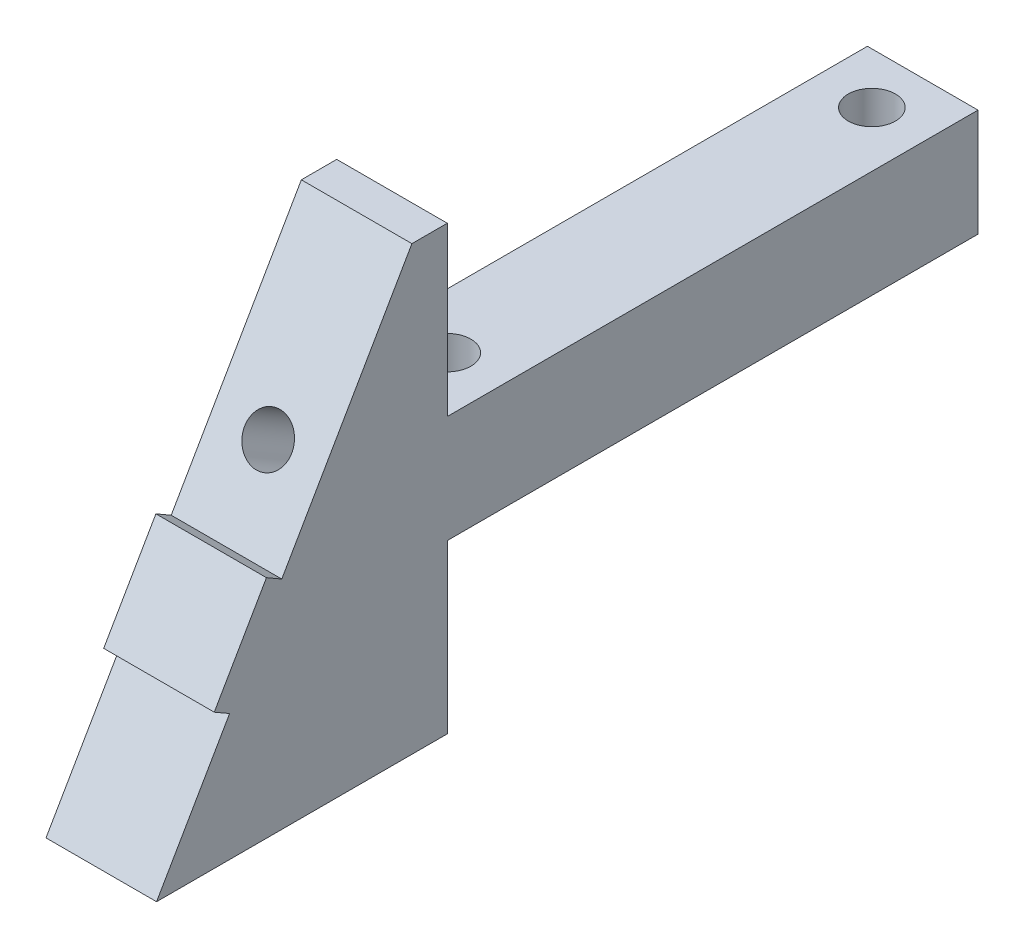
from build123d import *

# Parameters (mm, degrees)
BOSS_EXTRUDE1_DEPTH           = 6.35
SKETCH2_W                     = 6.35
SKETCH2_H                     = 6.35
BOSS_EXTRUDE2_DEPTH           = 30.48
SKETCH10_W                    = 6.35
SKETCH10_H                    = 6.1722
BOSS_EXTRUDE3_DEPTH           = 1.016
TAP_DRILL_FOR_6_32_TAP4_D     = 2.7051
TAP_DRILL_FOR_6_32_TAP4_DEPTH = 6.35
TAP_DRILL_FOR_6_32_TAP4_TIP   = 0.81269403
TAP_DRILL_FOR_6_32_TAP3_D     = 2.7051
SKETCH13_W                    = 6.35
SKETCH13_H                    = 30.48
CUT_EXTRUDE1_DEPTH            = 0.0889
SKETCH14_W                    = 6.35
SKETCH14_H                    = 30.48
CUT_EXTRUDE2_DEPTH            = 0.0889
SKETCH15_W                    = 6.35
SKETCH15_H                    = 1.016
CUT_EXTRUDE3_DEPTH            = 0.0889
SKETCH16_W                    = 6.35
SKETCH16_H                    = 1.016
CUT_EXTRUDE4_DEPTH            = 0.0889


with BuildPart() as part:
    # Sketch1 → Boss-Extrude1 (new body)
    with BuildSketch(Plane(origin=(0, 0, 0), x_dir=(0, 0, -1), z_dir=(1, 0, 0))):
        Polygon((0, 0), (0, 25.4), (-2.032, 25.4), (-16.696696837, 0), align=None)
    extrude(amount=BOSS_EXTRUDE1_DEPTH)

    # Sketch2 → Boss-Extrude2 (add)
    with BuildSketch(Plane(origin=(0, 0, 0), x_dir=(-1, 0, 0), z_dir=(0, 0, -1))):
        with Locations((-3.175, 12.7)):
            Rectangle(SKETCH2_W, SKETCH2_H)
    extrude(amount=BOSS_EXTRUDE2_DEPTH)

    # Sketch10 → Boss-Extrude3 (add)
    with BuildSketch(Plane(origin=(0, 7.22988181, 12.522522628), x_dir=(1, 0, 0), z_dir=(0, 0.49999999999999467, 0.8660254037844417))):
        with Locations((3.175, 3.035945256)):
            Rectangle(SKETCH10_W, SKETCH10_H)
    extrude(amount=BOSS_EXTRUDE3_DEPTH)

    # Tap Drill for #6-32 Tap4
    with Locations(Plane(origin=(0, 7.22988181, 12.522522628), x_dir=(1, 0, 0), z_dir=(0, 0.49999999999999467, 0.8660254037844417))):
        with Locations((3.175, 10.821045256)):
            Hole(TAP_DRILL_FOR_6_32_TAP4_D / 2, depth=TAP_DRILL_FOR_6_32_TAP4_DEPTH)
            with Locations((0, 0, -(TAP_DRILL_FOR_6_32_TAP4_DEPTH + TAP_DRILL_FOR_6_32_TAP4_TIP / 2))):  # 118° drill point
                Cone(0, TAP_DRILL_FOR_6_32_TAP4_D / 2, TAP_DRILL_FOR_6_32_TAP4_TIP, mode=Mode.SUBTRACT)

    # Tap Drill for #6-32 Tap3 (through all)
    with Locations(Plane(origin=(0, 15.875, 0), x_dir=(1, 0, 0), z_dir=(0, 1, 0))):
        with Locations((3.175, 3.175), (3.175, 27.559)):
            Hole(TAP_DRILL_FOR_6_32_TAP3_D / 2)

    # Sketch13 → Cut-Extrude1 (cut)
    with BuildSketch(Plane(origin=(0, 15.875, 0), x_dir=(1, 0, 0), z_dir=(0, 1, 0))):
        with Locations((3.175, 15.24)):
            Rectangle(SKETCH13_W, SKETCH13_H)
    extrude(amount=-CUT_EXTRUDE1_DEPTH, mode=Mode.SUBTRACT)

    # Sketch14 → Cut-Extrude2 (cut)
    with BuildSketch(Plane.XZ.offset(-9.525)):
        with Locations((3.175, -15.24)):
            Rectangle(SKETCH14_W, SKETCH14_H)
    extrude(amount=-CUT_EXTRUDE2_DEPTH, mode=Mode.SUBTRACT)

    # Sketch15 → Cut-Extrude3 (cut)
    with BuildSketch(Plane(origin=(0, 5.301846715, -3.061022628), x_dir=(1, 0, 0), z_dir=(0, 0.8660254037844417, -0.49999999999999467))):
        with Locations((3.175, -14.96776362)):
            Rectangle(SKETCH15_W, SKETCH15_H)
    extrude(amount=-CUT_EXTRUDE3_DEPTH, mode=Mode.SUBTRACT)

    # Sketch16 → Cut-Extrude4 (cut)
    with BuildSketch(Plane(origin=(0, -0.043435282, 0.025077372), x_dir=(1, 0, 0), z_dir=(0, -0.8660254037844417, 0.49999999999999467))):
        with Locations((3.175, 14.96776362)):
            Rectangle(SKETCH16_W, SKETCH16_H)
    extrude(amount=-CUT_EXTRUDE4_DEPTH, mode=Mode.SUBTRACT)


solid = part.part
